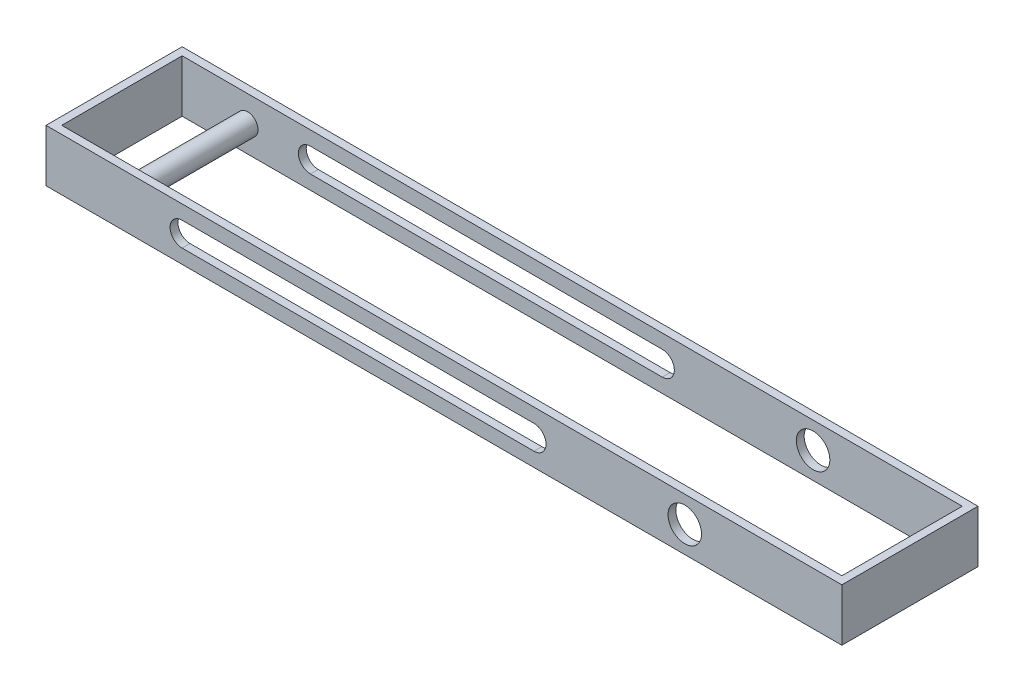
from build123d import *

# Parameters (mm, degrees)
SKETCH1_W           = 76
SKETCH1_H           = 13
SKETCH1_W_2         = 74.5
SKETCH1_H_2         = 11.5
BOSS_EXTRUDE1_DEPTH = 2.5
SKETCH2_R           = 1.6
CUT_EXTRUDE1_DEPTH  = 41.239905566
BOSS_EXTRUDE2_REACH = 42.004
SKETCH3_R           = 1


with BuildPart() as part:
    # Sketch1 → Boss-Extrude1 (new, symmetric)
    with BuildSketch(Plane(origin=(0, 0, 0), x_dir=(1, 0, 0), z_dir=(0, 1, 0))):
        Rectangle(SKETCH1_W, SKETCH1_H)
        Rectangle(SKETCH1_W_2, SKETCH1_H_2, mode=Mode.SUBTRACT)
    extrude(amount=BOSS_EXTRUDE1_DEPTH, both=True)

    # Sketch2 → Cut-Extrude1 (cut, through all)
    with BuildSketch(Plane.XY.offset(6.5)):
        with Locations((23, 0)):
            Circle(SKETCH2_R)
        with BuildLine():
            Line((-25, 1.15), (8.6, 1.15))
            ThreePointArc((8.6, 1.15), (9.75, 0), (8.6, -1.15))
            Line((8.6, -1.15), (-25, -1.15))
            ThreePointArc((-25, -1.15), (-26.15, 0), (-25, 1.15))
        make_face()
    extrude(amount=-CUT_EXTRUDE1_DEPTH, mode=Mode.SUBTRACT)

    # Sketch3 → Boss-Extrude2 (add, up to next)
    with BuildSketch(Plane.XY.offset(-5.75), mode=Mode.PRIVATE) as boss_extrude2_sk1:
        with Locations(Location((-31, 0, 0), (0, 0, 180))):
            Circle(SKETCH3_R)
    boss_extrude2_tool1 = extrude(boss_extrude2_sk1.sketch, amount=BOSS_EXTRUDE2_REACH, mode=Mode.PRIVATE) - part.part
    add(boss_extrude2_tool1.solids().sort_by_distance((-31, 0, -5.75))[0])


solid = part.part
